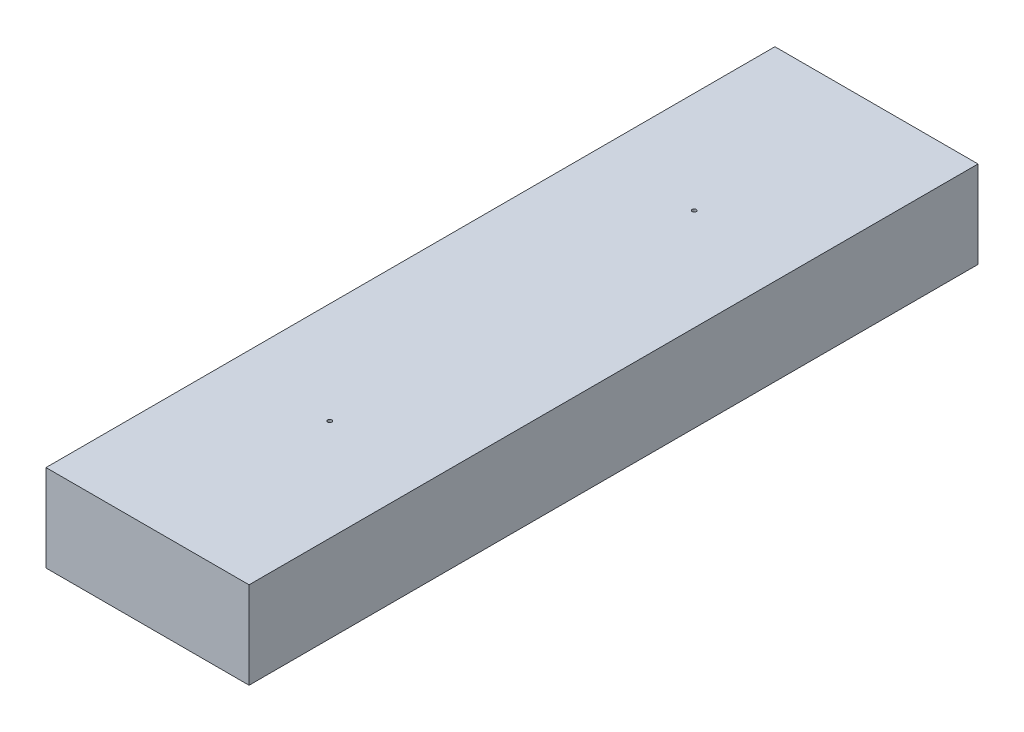
from build123d import *

# Parameters (mm, degrees)
SKETCH1_W           = 88.9
SKETCH1_H           = 38.1
BOSS_EXTRUDE1_DEPTH = 319.0875
SKETCH2_R           = 0.889
CUT_EXTRUDE1_DEPTH  = 38.1


with BuildPart() as part:
    # Sketch1 → Boss-Extrude1 (new body)
    with BuildSketch(Plane.XY):
        with Locations((44.45, 19.05)):
            Rectangle(SKETCH1_W, SKETCH1_H)
    extrude(amount=BOSS_EXTRUDE1_DEPTH)

    # Sketch2 → Cut-Extrude1 (cut)
    with BuildSketch(Plane.XZ):
        with Locations(Location((44.45, 79.771875, 0), (0, 0, 270))):
            Circle(SKETCH2_R)
        with Locations(Location((44.45, 239.315625, 0), (0, 0, 270))):
            Circle(SKETCH2_R)
    extrude(amount=-CUT_EXTRUDE1_DEPTH, mode=Mode.SUBTRACT)


solid = part.part
